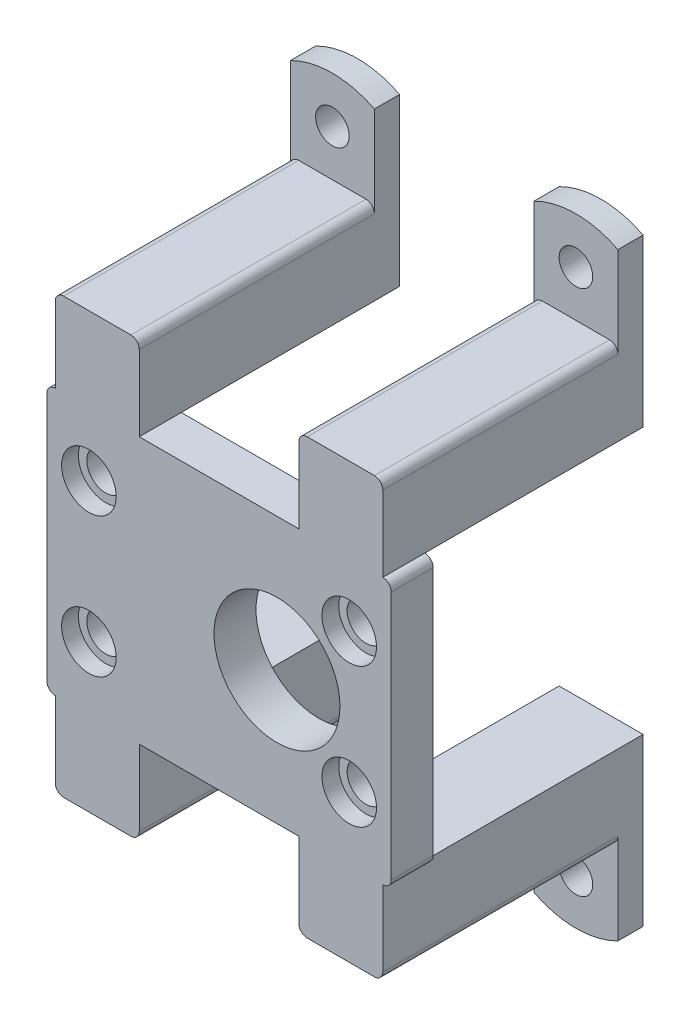
from build123d import *

# Parameters (mm, degrees)
SKETCH1_W           = 10
SKETCH1_H           = 10
SKETCH1_R           = 7.5
SKETCH1_R_2         = 2.25
BOSS_EXTRUDE1_DEPTH = 5
SKETCH2_W           = 10
SKETCH2_H           = 10
BOSS_EXTRUDE2_DEPTH = 26
SKETCH4_R           = 2
BOSS_EXTRUDE3_DEPTH = 3
FILLET1_R           = 1
SKETCH5_R           = 3.25
CUT_EXTRUDE1_DEPTH  = 2


with BuildPart() as part:
    # Sketch1 → Boss-Extrude1 (new body)
    # profile 1 of 5: a face of its own
    with BuildSketch(Plane.XY):
        with Locations((-14.5, 20.85)):
            Rectangle(SKETCH1_W, SKETCH1_H)
    # profile 2 of 5: a face of its own
    with BuildSketch(Plane.XY):
        with Locations((14.5, 20.85)):
            Rectangle(SKETCH1_W, SKETCH1_H)
    # profile 3 of 5: a face of its own
    with BuildSketch(Plane.XY):
        with BuildLine():
            Line((-20.5, -1.457145002), (-20.5, -14.85))
            ThreePointArc((-20.5, -14.85), (-20.207106781, -15.557106781), (-19.5, -15.85))
            Line((-19.5, -15.85), (19.5, -15.85))
            ThreePointArc((19.5, -15.85), (20.207106781, -15.557106781), (20.5, -14.85))
            Line((20.5, -14.85), (20.5, 14.85))
            ThreePointArc((20.5, 14.85), (20.207106781, 15.557106781), (19.5, 15.85))
            Line((19.5, 15.85), (-19.5, 15.85))
            ThreePointArc((-19.5, 15.85), (-20.207106781, 15.557106781), (-20.5, 14.85))
            Line((-20.5, 14.85), (-20.5, -1.457145002))
        make_face()
        with Locations((6.9, 0)):
            Circle(SKETCH1_R, mode=Mode.SUBTRACT)
        with Locations((15.5, 8.3)):
            Circle(SKETCH1_R_2, mode=Mode.SUBTRACT)
        with Locations((15.5, -8.3)):
            Circle(SKETCH1_R_2, mode=Mode.SUBTRACT)
        with Locations((-15.5, -8.3)):
            Circle(SKETCH1_R_2, mode=Mode.SUBTRACT)
        with Locations((-15.5, 8.3)):
            Circle(SKETCH1_R_2, mode=Mode.SUBTRACT)
    # profile 4 of 5: a face of its own
    with BuildSketch(Plane.XY):
        with Locations((14.5, -20.85)):
            Rectangle(SKETCH1_W, SKETCH1_H)
    # profile 5 of 5: a face of its own
    with BuildSketch(Plane.XY):
        with Locations((-14.5, -20.85)):
            Rectangle(SKETCH1_W, SKETCH1_H)
    extrude(amount=BOSS_EXTRUDE1_DEPTH)

    # Sketch2 → Boss-Extrude2 (add)
    with BuildSketch(Plane(origin=(0, 0, 0), x_dir=(-1, 0, 0), z_dir=(0, 0, -1))):
        with Locations((14.5, -20.85)):
            Rectangle(SKETCH2_W, SKETCH2_H)
        with Locations((-14.5, -20.85)):
            Rectangle(SKETCH2_W, SKETCH2_H)
        with Locations((14.5, 20.85)):
            Rectangle(SKETCH2_W, SKETCH2_H)
        with Locations((-14.5, 20.85)):
            Rectangle(SKETCH2_W, SKETCH2_H)
    extrude(amount=BOSS_EXTRUDE2_DEPTH)

    # Sketch4 → Boss-Extrude3 (add)
    # profile 1 of 4: a face of its own
    with BuildSketch(Plane(origin=(0, 0, -26), x_dir=(-1, 0, 0), z_dir=(0, 0, -1))):
        with BuildLine():
            Line((9.5, -25.85), (9.5, -35.647958971))
            ThreePointArc((9.5, -35.647958971), (14.5, -36.85), (19.5, -35.647958971))
            Line((19.5, -35.647958971), (19.5, -25.85))
            Line((19.5, -25.85), (9.5, -25.85))
        make_face()
        with Locations((14.5, -31.35)):
            Circle(SKETCH4_R, mode=Mode.SUBTRACT)
    # profile 2 of 4: a face of its own
    with BuildSketch(Plane(origin=(0, 0, -26), x_dir=(-1, 0, 0), z_dir=(0, 0, -1))):
        with BuildLine():
            Line((-19.5, -25.85), (-19.5, -35.647958971))
            ThreePointArc((-19.5, -35.647958971), (-14.5, -36.85), (-9.5, -35.647958971))
            Line((-9.5, -35.647958971), (-9.5, -25.85))
            Line((-9.5, -25.85), (-19.5, -25.85))
        make_face()
        with Locations(Location((-14.5, -31.35, 0), (0, 0, 180))):
            Circle(SKETCH4_R, mode=Mode.SUBTRACT)
    # profile 3 of 4: a face of its own
    with BuildSketch(Plane(origin=(0, 0, -26), x_dir=(-1, 0, 0), z_dir=(0, 0, -1))):
        with BuildLine():
            Line((19.5, 25.85), (19.5, 35.647958971))
            ThreePointArc((19.5, 35.647958971), (14.5, 36.85), (9.5, 35.647958971))
            Line((9.5, 35.647958971), (9.5, 25.85))
            Line((9.5, 25.85), (19.5, 25.85))
        make_face()
        with Locations(Location((14.5, 31.35, 0), (0, 0, 180))):
            Circle(SKETCH4_R, mode=Mode.SUBTRACT)
    # profile 4 of 4: a face of its own
    with BuildSketch(Plane(origin=(0, 0, -26), x_dir=(-1, 0, 0), z_dir=(0, 0, -1))):
        with BuildLine():
            Line((-9.5, 25.85), (-9.5, 35.647958971))
            ThreePointArc((-9.5, 35.647958971), (-14.5, 36.85), (-19.5, 35.647958971))
            Line((-19.5, 35.647958971), (-19.5, 25.85))
            Line((-19.5, 25.85), (-9.5, 25.85))
        make_face()
        with Locations((-14.5, 31.35)):
            Circle(SKETCH4_R, mode=Mode.SUBTRACT)
    extrude(amount=-BOSS_EXTRUDE3_DEPTH)

    # Fillet1
    fillet1_edges = [part.edges().sort_by_distance(p)[0] for p in [
        (9.5, 25.85, -9),
        (19.5, 25.85, -9),
        (19.5, -25.85, -9),
        (9.5, -25.85, -9),
        (-9.5, -25.85, -9),
        (-19.5, -25.85, -9),
        (-19.5, 25.85, -9),
        (-9.5, 25.85, -9),
    ]]
    fillet(fillet1_edges, radius=FILLET1_R)

    # Sketch5 → Cut-Extrude1 (cut)
    with BuildSketch(Plane.XY.offset(5)):
        with Locations((-15.5, -8.3)):
            Circle(SKETCH5_R)
        with Locations((-15.5, 8.3)):
            Circle(SKETCH5_R)
        with Locations((15.5, -8.3)):
            Circle(SKETCH5_R)
        with Locations(Location((15.5, 8.3, 0), (0, 0, 180))):
            Circle(SKETCH5_R)
    extrude(amount=-CUT_EXTRUDE1_DEPTH, mode=Mode.SUBTRACT)


solid = part.part
